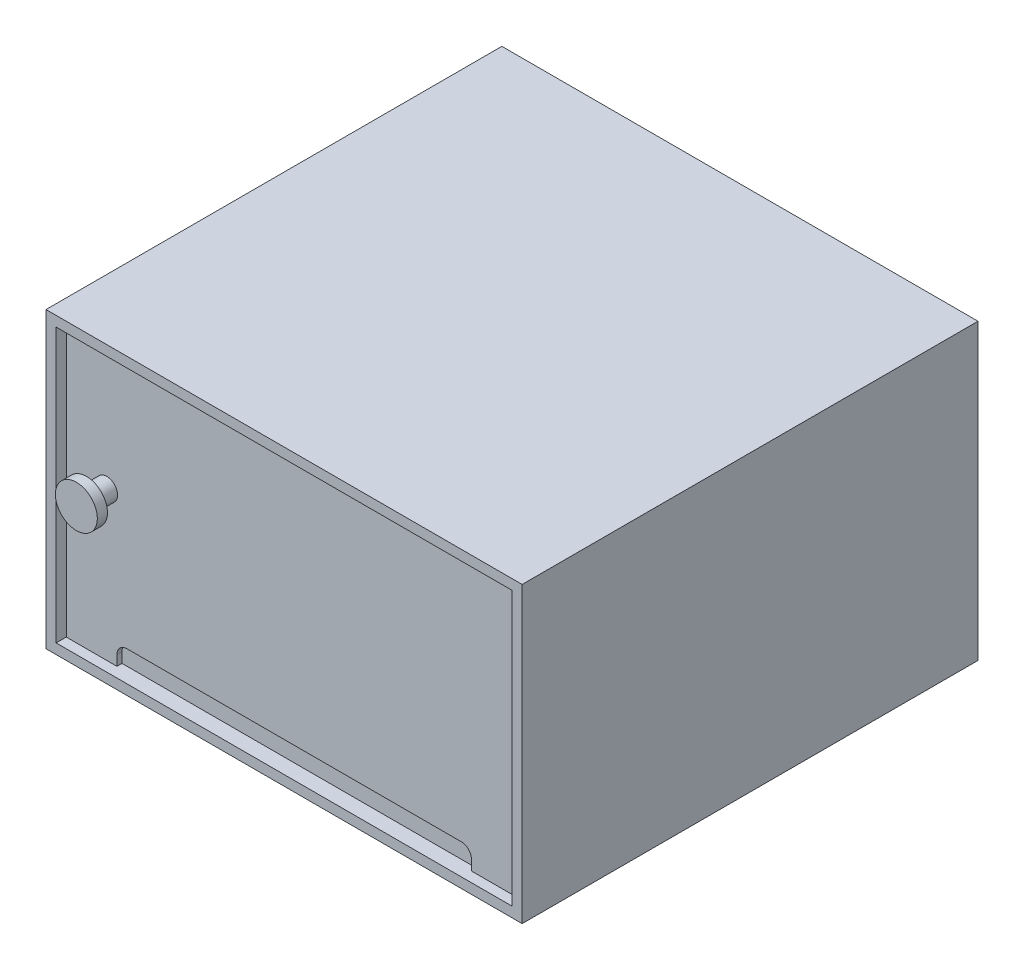
from build123d import *

# Parameters (mm, degrees)
SKETCH1_W           = 470
SKETCH1_H           = 450
BOSS_EXTRUDE1_DEPTH = 290
SHELL1_T            = -10
BOSS_EXTRUDE2_START = -20
SKETCH2_W           = 450
SKETCH2_H           = 270
BOSS_EXTRUDE2_DEPTH = 10
SKETCH3_W           = 350
SKETCH3_H           = 20
CUT_EXTRUDE1_DEPTH  = 5
FILLET1_R           = 10
SKETCH4_R           = 10.687155437
BOSS_EXTRUDE3_DEPTH = 20
SKETCH5_R           = 20.687155437
BOSS_EXTRUDE4_DEPTH = 10


with BuildPart() as part:
    # Sketch1 → Boss-Extrude1 (new body)
    with BuildSketch(Plane(origin=(0, 0, 0), x_dir=(1, 0, 0), z_dir=(0, 1, 0))):
        Rectangle(SKETCH1_W, SKETCH1_H)
    extrude(amount=BOSS_EXTRUDE1_DEPTH)

    # Shell1
    shell1_openings = [part.faces().sort_by_distance(p)[0] for p in [
        (0, 145, 225),
    ]]
    offset(amount=SHELL1_T, openings=shell1_openings, kind=Kind.INTERSECTION)

    # Sketch2 → Boss-Extrude2 (add)
    with BuildSketch(Plane.XY.offset(225).offset(BOSS_EXTRUDE2_START)):
        with Locations((0, 145)):
            Rectangle(SKETCH2_W, SKETCH2_H)
    extrude(amount=BOSS_EXTRUDE2_DEPTH)

    # Sketch3 → Cut-Extrude1 (cut)
    with BuildSketch(Plane.XY.offset(215)):
        with Locations((0, 20)):
            Rectangle(SKETCH3_W, SKETCH3_H)
    extrude(amount=-CUT_EXTRUDE1_DEPTH, mode=Mode.SUBTRACT)

    # Fillet1
    fillet1_edges = [part.edges().sort_by_distance(p)[0] for p in [
        (175, 30, 212.5),
        (-175, 30, 212.5),
    ]]
    fillet(fillet1_edges, radius=FILLET1_R)

    # Sketch4 → Boss-Extrude3 (add)
    with BuildSketch(Plane.XY.offset(215)):
        with Locations((-185.027804202, 156.673678499)):
            Circle(SKETCH4_R)
    extrude(amount=BOSS_EXTRUDE3_DEPTH)


with BuildPart() as body_2:
    # Sketch5 → Boss-Extrude4 (new body)
    with BuildSketch(Plane.XY.offset(235)):
        with Locations((-185.027804202, 156.673678499)):
            Circle(SKETCH5_R)
    extrude(amount=BOSS_EXTRUDE4_DEPTH)


solid = Compound([part.part, body_2.part])
